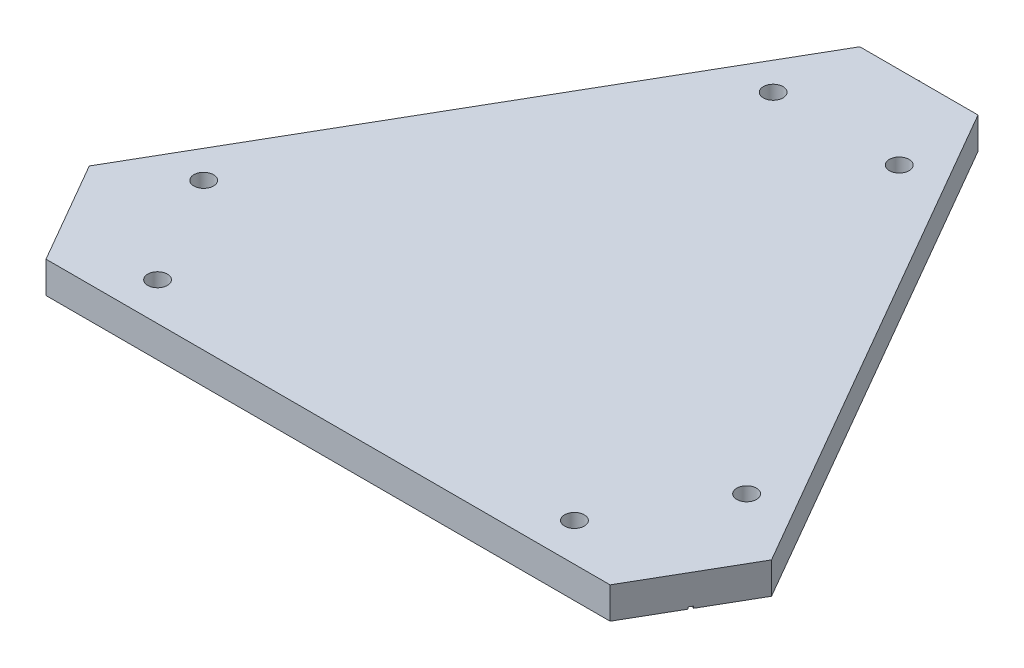
from build123d import *

# Parameters (mm, degrees)
SALIENTE_EXTRUIR2_DEPTH = 8
CROQUIS3_R              = 2.5
CORTAR_EXTRUIR1_DEPTH   = 31
CROQUIS4_W              = 0.1
CROQUIS4_H              = 0.1
SALIENTE_EXTRUIR3_DEPTH = 0.1
CROQUIS5_W              = 1
CROQUIS5_H              = 0.8740111
CORTAR_EXTRUIR2_DEPTH   = 10
CROQUIS6_W              = 1
CROQUIS6_H              = 1
CORTAR_EXTRUIR3_DEPTH   = 10
CROQUIS8_W              = 1
CROQUIS8_H              = 1
CORTAR_EXTRUIR4_DEPTH   = 10


with BuildPart() as part:
    # Croquis1 → Saliente-Extruir2 (new body)
    with BuildSketch(Plane(origin=(0, 0, 0), x_dir=(1, 0, 0), z_dir=(0, 1, 0))):
        Polygon((71.602540378, 0), (86.602540378, 25.980762114), (15, 150), (-15, 150), (-86.602540378, 25.980762114), (-71.602540378, 0), align=None)
    extrude(amount=SALIENTE_EXTRUIR2_DEPTH)

    # Croquis3 → Cortar-Extruir1 (cut)
    with BuildSketch(Plane(origin=(0, 8, 0), x_dir=(1, 0, 0), z_dir=(0, 1, 0))):
        with Locations(Location((-16, 129, 0), (0, 0, 270))):
            Circle(CROQUIS3_R)
        with Locations(Location((16, 129, 0), (0, 0, 270))):
            Circle(CROQUIS3_R)
        with Locations(Location((-52.916006899, 9.633974596, 0), (0, 0, 270))):
            Circle(CROQUIS3_R)
        with Locations(Location((-68.916006899, 37.346787517, 0), (0, 0, 270))):
            Circle(CROQUIS3_R)
        with Locations(Location((52.916006899, 9.633974596, 0), (0, 0, 270))):
            Circle(CROQUIS3_R)
        with Locations(Location((68.916006899, 37.346787517, 0), (0, 0, 270))):
            Circle(CROQUIS3_R)
    extrude(amount=-CORTAR_EXTRUIR1_DEPTH, mode=Mode.SUBTRACT)

    # Croquis4 → Saliente-Extruir3 (add)
    with BuildSketch(Plane(origin=(0, 8, 0), x_dir=(1, 0, 0), z_dir=(0, 1, 0))):
        with Locations((0, 150)):
            Rectangle(CROQUIS4_W, CROQUIS4_H)
    extrude(amount=SALIENTE_EXTRUIR3_DEPTH)

    # Croquis5 → Cortar-Extruir2 (cut)
    with BuildSketch(Plane(origin=(-53.701905284, 0, 31.004809472), x_dir=(0.5000000000000006, 0, 0.8660254037844384), z_dir=(-0.8660254037844384, 0, 0.5000000000000006))):
        with Locations((-50.801270189, 0)):
            Rectangle(CROQUIS5_W, CROQUIS5_H)
    extrude(amount=-CORTAR_EXTRUIR2_DEPTH, mode=Mode.SUBTRACT)

    # Croquis6 → Cortar-Extruir3 (cut)
    with BuildSketch(Plane(origin=(53.701905284, 0, 31.004809472), x_dir=(0.4999999999999996, 0, -0.8660254037844389), z_dir=(0.8660254037844389, 0, 0.4999999999999996))):
        with Locations((50.801270189, 0)):
            Rectangle(CROQUIS6_W, CROQUIS6_H)
    extrude(amount=-CORTAR_EXTRUIR3_DEPTH, mode=Mode.SUBTRACT)

    # Croquis8 → Cortar-Extruir4 (cut)
    with BuildSketch(Plane(origin=(0, 0, -150), x_dir=(-1, 0, 0), z_dir=(0, 0, -1))):
        Rectangle(CROQUIS8_W, CROQUIS8_H)
    extrude(amount=-CORTAR_EXTRUIR4_DEPTH, mode=Mode.SUBTRACT)


solid = part.part
